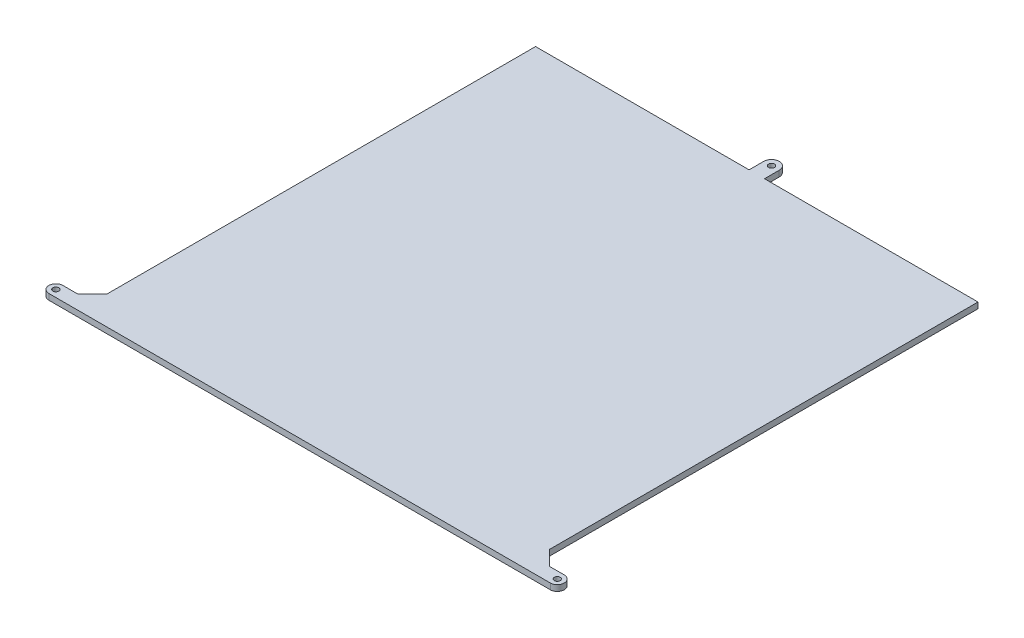
from build123d import *

# Parameters (mm, degrees)
SKETCH1_R           = 2
BOSS_EXTRUDE1_DEPTH = 4


with BuildPart() as part:
    # Sketch1 → Boss-Extrude1 (new body)
    with BuildSketch(Plane(origin=(0, 0, 0), x_dir=(1, 0, 0), z_dir=(0, 1, 0))):
        with BuildLine():
            ThreePointArc((-5.220792314, 160), (0, 165.220792314), (5.220792314, 160))
            Line((5.220792314, 160), (5.220792314, 150))
            Line((5.220792314, 150), (150, 150))
            Line((150, 150), (150, -140.527151098))
            Line((150, -140.527151098), (160, -150.527151098))
            Line((160, -150.527151098), (170, -150.527151098))
            ThreePointArc((170, -150.527151098), (174.736424451, -155.263575549), (170, -160))
            Line((170, -160), (-170, -160))
            ThreePointArc((-170, -160), (-174.736424451, -155.263575549), (-170, -150.527151098))
            Line((-170, -150.527151098), (-160, -150.527151098))
            Line((-160, -150.527151098), (-150, -140.527151098))
            Line((-150, -140.527151098), (-150, 150))
            Line((-150, 150), (-5.220792314, 150))
            Line((-5.220792314, 150), (-5.220792314, 160))
        make_face()
        with Locations(Location((170, -155.263575549, 0), (0, 0, 270))):
            Circle(SKETCH1_R, mode=Mode.SUBTRACT)
        with Locations(Location((-170, -155.263575549, 0), (0, 0, 270))):
            Circle(SKETCH1_R, mode=Mode.SUBTRACT)
        with Locations(Location((0, 160, 0), (0, 0, 270))):
            Circle(SKETCH1_R, mode=Mode.SUBTRACT)
    extrude(amount=BOSS_EXTRUDE1_DEPTH)


solid = part.part
